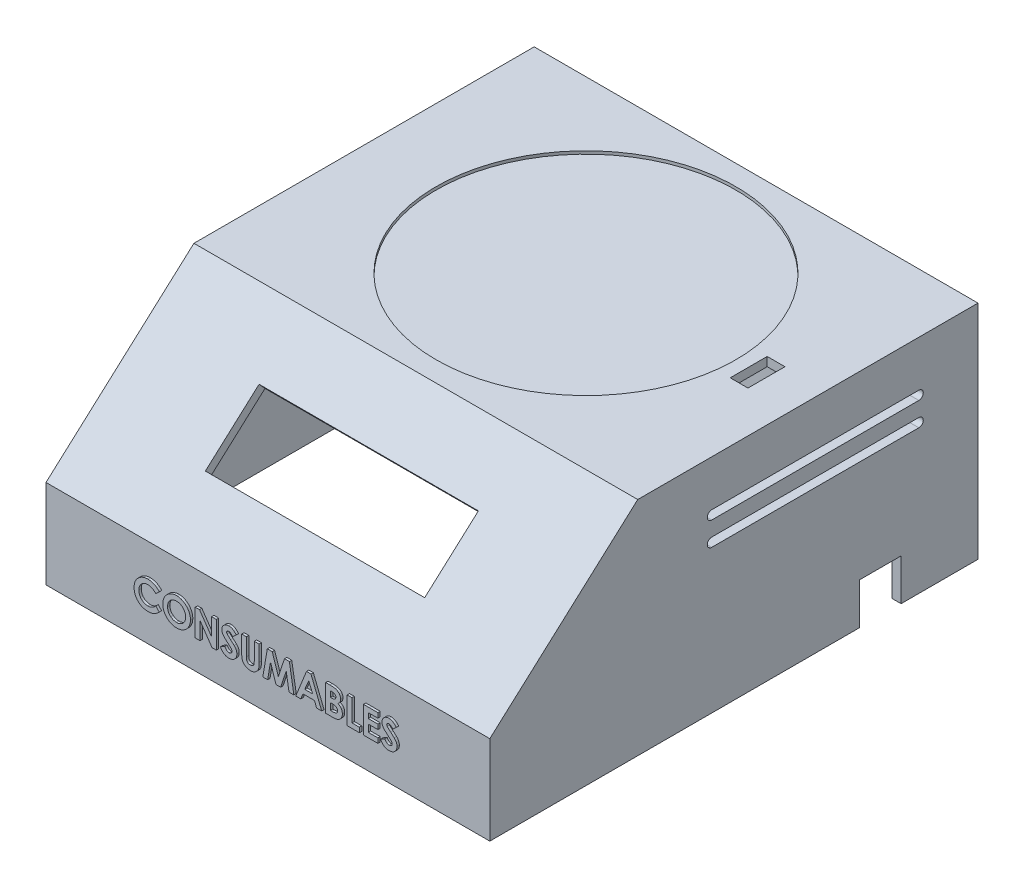
from build123d import *

# Parameters (mm, degrees)
BLOCK_DEPTH                = 150
SHELL1_T                   = -3
SKETCH2_R                  = 5
FLOOR_COLUMNS_DEPTH        = 20
SKETCH3_R                  = 2
FLOOR_INSERT_HOLES_DEPTH   = 7
SKETCH4_R                  = 50.675
SCALE_RECESS_DEPTH         = 1
SKETCH5_W                  = 6
SKETCH5_H                  = 12.5
LOAD_CELL_CABLE_SLOT_DEPTH = 4
SKETCH6_W                  = 74.13
SKETCH6_H                  = 24.42
LCD_WINDOW_DEPTH           = 4
SKETCH7_R                  = 2.5
LCD_BOSSES_DEPTH           = 5.6
SKETCH8_R                  = 1.1
LCD_M2_5_PILOTS_DEPTH      = 7.6
SKETCH9_W                  = 14
SKETCH9_H                  = 14
USB_ACCESS_DEPTH           = 4
SKETCH10_R                 = 8.15
DC_IN_DEPTH                = 4
VENTS_LEFT_DEPTH           = 4
VENTS_START                = -4
VENTS_RIGHT_DEPTH          = 4
TITLE_RAISED_DEPTH         = 0.8


with BuildPart() as part:
    # Sketch1 → Block (new body)
    with BuildSketch(Plane(origin=(-75, 0, 0), x_dir=(0, 0, -1), z_dir=(1, 0, 0))):
        Polygon((0, 0), (-165, 0), (-165, 30), (-115, 75), (0, 75), align=None)
    extrude(amount=BLOCK_DEPTH)

    # Shell1
    shell1_openings = [part.faces().sort_by_distance(p)[0] for p in [
        (0, 0, 82.5),
    ]]
    offset(amount=SHELL1_T, openings=shell1_openings, kind=Kind.INTERSECTION)

    # Sketch2 → Floor columns (add)
    with BuildSketch(Plane(origin=(0, 0, 0), x_dir=(1, 0, 0), z_dir=(0, 1, 0))):
        with Locations((-68, -7)):
            Circle(SKETCH2_R)
        with Locations((68, -7)):
            Circle(SKETCH2_R)
        with Locations((-68, -158)):
            Circle(SKETCH2_R)
        with Locations((68, -158)):
            Circle(SKETCH2_R)
    extrude(amount=FLOOR_COLUMNS_DEPTH)

    # Sketch3 → Floor insert holes (cut)
    with BuildSketch(Plane(origin=(0, 0, 0), x_dir=(1, 0, 0), z_dir=(0, 1, 0))):
        with Locations(Location((-68, -7, 0), (0, 0, 270))):
            Circle(SKETCH3_R)
        with Locations(Location((68, -7, 0), (0, 0, 270))):
            Circle(SKETCH3_R)
        with Locations(Location((-68, -158, 0), (0, 0, 270))):
            Circle(SKETCH3_R)
        with Locations(Location((68, -158, 0), (0, 0, 270))):
            Circle(SKETCH3_R)
    extrude(amount=FLOOR_INSERT_HOLES_DEPTH, mode=Mode.SUBTRACT)

    # Sketch4 → Scale recess (cut)
    with BuildSketch(Plane(origin=(0, 75, 0), x_dir=(1, 0, 0), z_dir=(0, 1, 0))):
        with Locations(Location((0, -57.5, 0), (0, 0, 270))):
            Circle(SKETCH4_R)
    extrude(amount=-SCALE_RECESS_DEPTH, mode=Mode.SUBTRACT)

    # Sketch5 → Load-cell cable slot (cut)
    with BuildSketch(Plane(origin=(0, 75, 0), x_dir=(1, 0, 0), z_dir=(0, 1, 0))):
        with Locations((58, -57.5)):
            Rectangle(SKETCH5_W, SKETCH5_H)
    extrude(amount=-LOAD_CELL_CABLE_SLOT_DEPTH, mode=Mode.SUBTRACT)

    # Sketch6 → LCD window (cut)
    with BuildSketch(Plane(origin=(0, 98.61878453, 88.756906077), x_dir=(1, 0, 0), z_dir=(0, 0.7432941462471663, 0.6689647316224498))):
        with Locations((0, -68.940532064)):
            Rectangle(SKETCH6_W, SKETCH6_H)
    extrude(amount=-LCD_WINDOW_DEPTH, mode=Mode.SUBTRACT)

    # Sketch7 → LCD bosses (add)
    with BuildSketch(Plane(origin=(0, 96.388902092, 86.750011882), x_dir=(1, 0, 0), z_dir=(0, -0.7432941462471663, -0.6689647316224498))):
        with Locations(Location((-37.5, 84.440532064, 0), (0, 0, 270))):
            Circle(SKETCH7_R)
        with Locations(Location((-37.5, 53.440532064, 0), (0, 0, 270))):
            Circle(SKETCH7_R)
        with Locations(Location((37.5, 84.440532064, 0), (0, 0, 270))):
            Circle(SKETCH7_R)
        with Locations(Location((37.5, 53.440532064, 0), (0, 0, 270))):
            Circle(SKETCH7_R)
    extrude(amount=LCD_BOSSES_DEPTH)

    # Sketch8 → LCD M2.5 pilots (cut)
    with BuildSketch(Plane(origin=(0, 92.226454873, 83.003809385), x_dir=(1, 0, 0), z_dir=(0, -0.743294146247166, -0.66896473162245))):
        with Locations(Location((-37.5, 84.440532064, 0), (0, 0, 270))):
            Circle(SKETCH8_R)
        with Locations(Location((-37.5, 53.440532064, 0), (0, 0, 270))):
            Circle(SKETCH8_R)
        with Locations(Location((37.5, 84.440532064, 0), (0, 0, 270))):
            Circle(SKETCH8_R)
        with Locations(Location((37.5, 53.440532064, 0), (0, 0, 270))):
            Circle(SKETCH8_R)
    extrude(amount=-LCD_M2_5_PILOTS_DEPTH, mode=Mode.SUBTRACT)

    # Sketch9 → USB access (cut)
    with BuildSketch(Plane(origin=(75, 0, 0), x_dir=(0, 0, -1), z_dir=(1, 0, 0))):
        with Locations((-33, 7)):
            Rectangle(SKETCH9_W, SKETCH9_H)
    extrude(amount=-USB_ACCESS_DEPTH, mode=Mode.SUBTRACT)

    # Sketch10 → DC in (cut)
    with BuildSketch(Plane.XY):
        with Locations((-38, 45)):
            Circle(SKETCH10_R)
    extrude(amount=DC_IN_DEPTH, mode=Mode.SUBTRACT)

    # Sketch11 → Vents left (cut)
    with BuildSketch(Plane(origin=(-75, 0, 0), x_dir=(0, 0, -1), z_dir=(1, 0, 0))):
        with BuildLine():
            Line((-20, 48.5), (-90, 48.5))
            ThreePointArc((-90, 48.5), (-91.5, 50), (-90, 51.5))
            Line((-90, 51.5), (-20, 51.5))
            ThreePointArc((-20, 51.5), (-18.5, 50), (-20, 48.5))
        make_face()
        with BuildLine():
            Line((-20, 56.5), (-90, 56.5))
            ThreePointArc((-90, 56.5), (-91.5, 58), (-90, 59.5))
            Line((-90, 59.5), (-20, 59.5))
            ThreePointArc((-20, 59.5), (-18.5, 58), (-20, 56.5))
        make_face()
    extrude(amount=VENTS_LEFT_DEPTH, mode=Mode.SUBTRACT)

    # Sketch12 → Vents right (cut)
    with BuildSketch(Plane(origin=(75, 0, 0), x_dir=(0, 0, -1), z_dir=(1, 0, 0)).offset(VENTS_START)):
        with BuildLine():
            Line((-20, 48.5), (-90, 48.5))
            ThreePointArc((-90, 48.5), (-91.5, 50), (-90, 51.5))
            Line((-90, 51.5), (-20, 51.5))
            ThreePointArc((-20, 51.5), (-18.5, 50), (-20, 48.5))
        make_face()
        with BuildLine():
            Line((-20, 56.5), (-90, 56.5))
            ThreePointArc((-90, 56.5), (-91.5, 58), (-90, 59.5))
            Line((-90, 59.5), (-20, 59.5))
            ThreePointArc((-20, 59.5), (-18.5, 58), (-20, 56.5))
        make_face()
    extrude(amount=VENTS_RIGHT_DEPTH, mode=Mode.SUBTRACT)

    # Sketch13 → Title (raised) (add)
    # profile 1 of 11: a face of its own
    with BuildSketch(Plane.XY.offset(165)):
        with BuildLine():
            Line((-35.884615385, 17.938701923), (-37.069110577, 16.806490385))
            add(Edge.make_bspline(
                [(-37.069110577, 16.806490385), (-37.169589109, 16.910385355), (-37.365855161, 17.113324782), (-37.682113631, 17.381998698), (-38.011010925, 17.605902055), (-38.346149001, 17.794472036), (-38.693556024, 17.937138667), (-39.049215022, 18.041102243), (-39.415396981, 18.104484906), (-39.663214846, 18.111737005), (-39.787860577, 18.115384615)],
                knots=[0, 0, 0, 0, 1.115251505, 2.178435587, 3.19620269, 4.182487026, 5.141301733, 6.088180966, 7.038406374, 8, 8, 8, 8], degree=3))
            add(Edge.make_bspline(
                [(-39.787860577, 18.115384615), (-39.891954909, 18.112502875), (-40.097373605, 18.106816079), (-40.398982081, 18.065126253), (-40.687486175, 17.994230889), (-40.963873483, 17.896523946), (-41.227330724, 17.770096346), (-41.478410268, 17.615045943), (-41.71649309, 17.432773062), (-41.938434252, 17.224220791), (-42.141458227, 16.996361762), (-42.320842836, 16.753236722), (-42.471106222, 16.495402657), (-42.594424938, 16.22547072), (-42.690485451, 15.942191533), (-42.759084726, 15.64575581), (-42.798760713, 15.33581052), (-42.80468262, 15.125112021), (-42.807692308, 15.018028846)],
                knots=[0, 0, 0, 0, 1.035432265, 2.043311493, 3.022114605, 3.98653278, 4.95457646, 5.923598177, 6.917315552, 7.932509744, 8.948865224, 9.949768934, 10.933144597, 11.912367597, 12.897413939, 13.903909035, 14.934704909, 16, 16, 16, 16], degree=3))
            add(Edge.make_bspline(
                [(-42.807692308, 15.018028846), (-42.80682495, 14.942870381), (-42.805115371, 14.794731503), (-42.786400999, 14.575592988), (-42.756266447, 14.362976821), (-42.712654285, 14.157205059), (-42.658116847, 13.95809938), (-42.594132014, 13.763942108), (-42.513863983, 13.577416059), (-42.424765257, 13.396354855), (-42.321144466, 13.225698977), (-42.209422138, 13.062964435), (-42.088277513, 12.908948936), (-41.956925931, 12.764282101), (-41.813518782, 12.631224748), (-41.66176261, 12.505775684), (-41.499097499, 12.391075325), (-41.328902414, 12.284245139), (-41.149707086, 12.191440847), (-40.9663735, 12.107378088), (-40.776121948, 12.039106629), (-40.581268857, 11.984073605), (-40.382510564, 11.937276237), (-40.177903029, 11.908461659), (-39.969219941, 11.886640717), (-39.828185201, 11.885293401), (-39.757211538, 11.884615385)],
                knots=[0, 0, 0, 0, 1.103660481, 2.175337485, 3.227646561, 4.255952547, 5.262355991, 6.258840057, 7.255597736, 8.242457506, 9.22035537, 10.185017736, 11.140346927, 12.096287581, 13.051739095, 14.01125915, 14.986044842, 15.97314143, 16.960198552, 17.947847494, 18.933482797, 19.925264591, 20.920966487, 21.929612487, 22.958107872, 24, 24, 24, 24], degree=3))
            add(Edge.make_bspline(
                [(-39.757211538, 11.884615385), (-39.636828009, 11.888097515), (-39.400305679, 11.894938996), (-39.05317515, 11.948438408), (-38.722394338, 12.036441914), (-38.458102053, 12.140368941), (-38.251036028, 12.242998229), (-38.093399725, 12.337925267), (-37.930391501, 12.444111581), (-37.764718783, 12.565564757), (-37.594518083, 12.70082731), (-37.422793836, 12.852861741), (-37.245149869, 13.016661775), (-37.128777067, 13.133569077), (-37.069110577, 13.193509615)],
                knots=[0, 0, 0, 0, 1.404581149, 2.759636711, 4.088442092, 5.392261763, 6.066678138, 6.783632037, 7.538459478, 8.336747902, 9.180226004, 10.074962426, 11.012997595, 12, 12, 12, 12], degree=3))
            Line((-37.069110577, 13.193509615), (-35.920673077, 11.987379808))
            add(Edge.make_bspline(
                [(-35.920673077, 11.987379808), (-36.001402052, 11.909438517), (-36.158967746, 11.757313786), (-36.396651221, 11.541310863), (-36.634035563, 11.347208225), (-36.865386059, 11.167960797), (-37.094492472, 11.00879049), (-37.321330507, 10.869538341), (-37.543332256, 10.746682461), (-37.765107658, 10.642294754), (-37.988036713, 10.553658749), (-38.217404514, 10.477348966), (-38.453912258, 10.412793636), (-38.699004428, 10.360705962), (-38.950394952, 10.318938679), (-39.210436513, 10.290746005), (-39.477480317, 10.271793008), (-39.658620267, 10.270089925), (-39.75, 10.269230769)],
                knots=[0, 0, 0, 0, 1.244526981, 2.429050516, 3.560637417, 4.644440555, 5.67424972, 6.652764056, 7.595344123, 8.486817594, 9.369275933, 10.254498637, 11.166417451, 12.086725134, 13.032340136, 13.991389299, 14.986715468, 16, 16, 16, 16], degree=3))
            add(Edge.make_bspline(
                [(-39.75, 10.269230769), (-39.91785325, 10.273509683), (-40.246295403, 10.281882329), (-40.727618814, 10.343917963), (-41.184863135, 10.447919611), (-41.619140754, 10.595006627), (-42.030313582, 10.782903397), (-42.418276429, 11.013256014), (-42.782403983, 11.285452467), (-43.119754813, 11.59630235), (-43.424904693, 11.939609951), (-43.694621849, 12.30822813), (-43.91773189, 12.703968512), (-44.102984965, 13.120984747), (-44.247850433, 13.561179843), (-44.349811164, 14.025029955), (-44.412689603, 14.512087208), (-44.419568593, 14.84475854), (-44.423076923, 15.014423077)],
                knots=[0, 0, 0, 0, 1.078019885, 2.10938526, 3.111377082, 4.085535484, 5.04941344, 6.010039228, 6.978205633, 7.964457913, 8.951525778, 9.924444315, 10.892603023, 11.863865945, 12.85144698, 13.863884204, 14.910567087, 16, 16, 16, 16], degree=3))
            add(Edge.make_bspline(
                [(-44.423076923, 15.014423077), (-44.421594473, 15.125076841), (-44.418656619, 15.344365555), (-44.387779503, 15.667395598), (-44.344735008, 15.982292109), (-44.27644883, 16.285785418), (-44.194136578, 16.581964141), (-44.091770478, 16.867609159), (-43.969514022, 17.143541446), (-43.831307825, 17.41022293), (-43.674956537, 17.66590656), (-43.500294984, 17.908395611), (-43.311819636, 18.139562054), (-43.105001736, 18.356339037), (-42.882846621, 18.560629904), (-42.644351285, 18.751327564), (-42.390950158, 18.931166836), (-42.121957378, 19.095510102), (-41.842598759, 19.244167322), (-41.556397746, 19.375289339), (-41.264057503, 19.484877149), (-40.966814071, 19.575776196), (-40.6634116, 19.643625907), (-40.3560157, 19.694985949), (-40.042010801, 19.723696541), (-39.831183714, 19.728396648), (-39.724759615, 19.730769231)],
                knots=[0, 0, 0, 0, 1.071919942, 2.124283339, 3.142214191, 4.149696895, 5.136002878, 6.119640489, 7.086990633, 8.058538607, 9.028339693, 9.988281803, 10.952401235, 11.916291999, 12.888973767, 13.874849856, 14.873389453, 15.898127285, 16.927174885, 17.938320013, 18.946391617, 19.950418109, 20.947802303, 21.956882652, 22.968648068, 24, 24, 24, 24], degree=3))
            add(Edge.make_bspline(
                [(-39.724759615, 19.730769231), (-39.633968947, 19.729409207), (-39.45333158, 19.726703301), (-39.184332228, 19.704146625), (-38.917484207, 19.668721594), (-38.653742915, 19.615272767), (-38.391221805, 19.551822255), (-38.133370697, 19.468742561), (-37.876121851, 19.376134586), (-37.623509834, 19.265440661), (-37.375182036, 19.144608243), (-37.136955926, 19.007519477), (-36.904831711, 18.862610653), (-36.683953124, 18.70130543), (-36.470182633, 18.52945465), (-36.264638062, 18.346256531), (-36.069123187, 18.148656625), (-35.946428906, 18.009040626), (-35.884615385, 17.938701923)],
                knots=[0, 0, 0, 0, 0.996412454, 1.982464992, 2.961075852, 3.949442424, 4.934965278, 5.923860011, 6.921385422, 7.934793307, 8.949617135, 9.951082467, 10.950285876, 11.951772932, 12.951063433, 13.960125323, 14.972308753, 16, 16, 16, 16], degree=3))
        make_face()
    # profile 2 of 11: a face of its own
    with BuildSketch(Plane.XY.offset(165)):
        with BuildLine():
            add(Edge.make_bspline(
                [(-30.039663462, 19.730769231), (-29.883187431, 19.726717786), (-29.574268307, 19.718719317), (-29.119959752, 19.652045832), (-28.682149458, 19.543410948), (-28.261035402, 19.392400601), (-27.857672004, 19.194924664), (-27.470636467, 18.95658171), (-27.101315134, 18.672873157), (-26.753492514, 18.350417459), (-26.432041682, 17.999760967), (-26.153504348, 17.622216912), (-25.915977928, 17.227567839), (-25.719115395, 16.814756275), (-25.569167935, 16.380923302), (-25.463943599, 15.928280896), (-25.396342177, 15.456957829), (-25.388566974, 15.136051062), (-25.384615385, 14.972956731)],
                knots=[0, 0, 0, 0, 1.014329547, 2.002516266, 2.970391464, 3.935626869, 4.897733899, 5.877609409, 6.878433252, 7.912639331, 8.949961323, 9.958554974, 10.949718813, 11.932905612, 12.9188844, 13.919928257, 14.942845884, 16, 16, 16, 16], degree=3))
            add(Edge.make_bspline(
                [(-25.384615385, 14.972956731), (-25.388823656, 14.811700096), (-25.397116189, 14.493938724), (-25.461183814, 14.026959084), (-25.56818014, 13.579165421), (-25.715584374, 13.149544144), (-25.908876564, 12.74017619), (-26.14177096, 12.348447802), (-26.420413202, 11.977994313), (-26.734640114, 11.629014523), (-27.080576674, 11.312240481), (-27.446978408, 11.033083904), (-27.832153499, 10.796537154), (-28.235538173, 10.602708583), (-28.65799747, 10.452285368), (-29.098487863, 10.346150859), (-29.556982095, 10.281650775), (-29.868780408, 10.273412407), (-30.027043269, 10.269230769)],
                knots=[0, 0, 0, 0, 1.051557043, 2.072126891, 3.067553643, 4.050577992, 5.02905126, 6.015227836, 7.017913613, 8.04756643, 9.074058332, 10.072836633, 11.047628519, 12.017157415, 12.98668631, 13.966869689, 14.968021931, 16, 16, 16, 16], degree=3))
            add(Edge.make_bspline(
                [(-30.027043269, 10.269230769), (-30.192567246, 10.272981905), (-30.517799234, 10.280352373), (-30.993777705, 10.350442159), (-31.449806209, 10.456021863), (-31.882053842, 10.613593906), (-32.294922679, 10.810572209), (-32.68537925, 11.0531628), (-33.053292336, 11.340964777), (-33.396551527, 11.666607426), (-33.707545186, 12.022931909), (-33.982058091, 12.399357126), (-34.213615817, 12.793007521), (-34.402226834, 13.204067329), (-34.550920184, 13.629981915), (-34.655806447, 14.07334522), (-34.717765266, 14.533093899), (-34.72639577, 14.845364393), (-34.730769231, 15.003605769)],
                knots=[0, 0, 0, 0, 1.067978421, 2.098431617, 3.099715153, 4.085208694, 5.062210972, 6.048429807, 7.046490867, 8.072918869, 9.098532598, 10.095778865, 11.076610158, 12.041847152, 13.011192615, 13.984257998, 14.978533688, 16, 16, 16, 16], degree=3))
            add(Edge.make_bspline(
                [(-34.730769231, 15.003605769), (-34.729396587, 15.110062283), (-34.72666868, 15.321627328), (-34.693808165, 15.635155925), (-34.646498471, 15.942564864), (-34.576529679, 16.242628503), (-34.49153548, 16.53746365), (-34.381413489, 16.824325906), (-34.256064862, 17.10627975), (-34.109606793, 17.379994953), (-33.946759581, 17.642953107), (-33.769078774, 17.893913793), (-33.576117597, 18.129842529), (-33.36849764, 18.352289741), (-33.145503418, 18.559793267), (-32.910068188, 18.75529061), (-32.65762588, 18.933588664), (-32.393701662, 19.099041823), (-32.119783478, 19.248658246), (-31.836986425, 19.376007271), (-31.551136679, 19.487219004), (-31.258415675, 19.574992222), (-30.961960438, 19.64648259), (-30.658603944, 19.693760397), (-30.351086848, 19.726620001), (-30.143717614, 19.729382872), (-30.039663462, 19.730769231)],
                knots=[0, 0, 0, 0, 1.034744296, 2.056386356, 3.06226378, 4.057406941, 5.050368692, 6.043467995, 7.042652155, 8.049140477, 9.059438543, 10.048523776, 11.036952808, 12.020949711, 13.004946614, 13.997082645, 14.994316842, 16.007702937, 17.024872941, 18.026463647, 19.021641123, 20.005082605, 20.995858141, 21.984425357, 22.988620895, 24, 24, 24, 24], degree=3))
        make_face()
        with BuildLine():
            add(Edge.make_bspline(
                [(-30.064903846, 18.115384615), (-30.170212194, 18.112558956), (-30.378048731, 18.106982235), (-30.682907081, 18.064495164), (-30.975581863, 17.996638483), (-31.254450666, 17.898348908), (-31.520722129, 17.773251227), (-31.774868272, 17.621782544), (-32.013369694, 17.438736293), (-32.239406582, 17.233939411), (-32.443593716, 17.00574862), (-32.62399949, 16.761203379), (-32.774970065, 16.500712075), (-32.901408867, 16.226694611), (-32.996589263, 15.936069732), (-33.064383405, 15.631113936), (-33.107226772, 15.311301767), (-33.112627231, 15.093286228), (-33.115384615, 14.981971154)],
                knots=[0, 0, 0, 0, 1.033739768, 2.040188636, 3.016340934, 3.979330865, 4.937572243, 5.900995986, 6.878200029, 7.884839167, 8.891893314, 9.879764717, 10.863503415, 11.843163062, 12.837761627, 13.859916423, 14.907309254, 16, 16, 16, 16], degree=3))
            add(Edge.make_bspline(
                [(-33.115384615, 14.981971154), (-33.111728745, 14.858609012), (-33.104563845, 14.616839653), (-33.054150738, 14.264153027), (-32.967898929, 13.931075513), (-32.843352994, 13.619236143), (-32.68888336, 13.325172174), (-32.497056591, 13.052487779), (-32.270979371, 12.799550251), (-32.096811313, 12.651874786), (-32.008413462, 12.576923077)],
                knots=[0, 0, 0, 0, 1.078454662, 2.113592447, 3.107694534, 4.079536787, 5.043276885, 6.005368276, 6.987637804, 8, 8, 8, 8], degree=3))
            add(Edge.make_bspline(
                [(-32.008413462, 12.576923077), (-31.935998745, 12.521551633), (-31.792800829, 12.412056272), (-31.564225777, 12.271715505), (-31.328838483, 12.151429468), (-31.084862653, 12.054239773), (-30.832813552, 11.977791993), (-30.572725745, 11.924256869), (-30.304967752, 11.890658949), (-30.123897249, 11.886643361), (-30.032451923, 11.884615385)],
                knots=[0, 0, 0, 0, 1.023928204, 2.024787132, 3.009472467, 3.9914905, 4.972207045, 5.96565515, 6.972602802, 8, 8, 8, 8], degree=3))
            add(Edge.make_bspline(
                [(-30.032451923, 11.884615385), (-29.928954355, 11.887465002), (-29.725319635, 11.893071715), (-29.426136388, 11.935035747), (-29.13950975, 12.00605404), (-28.863660319, 12.103481383), (-28.599383522, 12.230149775), (-28.347970951, 12.386316541), (-28.108981812, 12.570064156), (-27.883232892, 12.777550469), (-27.676887708, 13.006640174), (-27.496858403, 13.252489794), (-27.341087718, 13.509682526), (-27.217278213, 13.781858542), (-27.118337455, 14.066448629), (-27.051359251, 14.364713175), (-27.008153954, 14.675422619), (-27.002751973, 14.886871377), (-27, 14.994591346)],
                knots=[0, 0, 0, 0, 1.026359118, 2.019393844, 2.989460624, 3.950973911, 4.916101784, 5.890408035, 6.881132271, 7.902007068, 8.92769091, 9.933912415, 10.920395702, 11.90457117, 12.894218921, 13.903490204, 14.931958862, 16, 16, 16, 16], degree=3))
            add(Edge.make_bspline(
                [(-27, 14.994591346), (-27.002847192, 15.101691896), (-27.008451454, 15.312502995), (-27.050489345, 15.622413608), (-27.121057258, 15.919361403), (-27.218777165, 16.203831328), (-27.343560312, 16.476102268), (-27.497867332, 16.735216757), (-27.681156781, 16.980924297), (-27.889210264, 17.211550483), (-28.115663692, 17.423481175), (-28.358784075, 17.607398491), (-28.61176863, 17.767216791), (-28.880422059, 17.892411993), (-29.159247935, 17.992154746), (-29.449947671, 18.06560674), (-29.753622309, 18.106683761), (-29.960218443, 18.112458478), (-30.064903846, 18.115384615)],
                knots=[0, 0, 0, 0, 1.055025985, 2.07665775, 3.074803781, 4.057872707, 5.035505728, 6.020516407, 7.023567878, 8.050795229, 9.077271434, 10.074415901, 11.050397877, 12.019801805, 12.988065821, 13.964604439, 14.968634123, 16, 16, 16, 16], degree=3))
        make_face(mode=Mode.SUBTRACT)
    # profile 3 of 11: a face of its own
    with BuildSketch(Plane.XY.offset(165)):
        Polygon((-23.769230769, 19.5), (-22.314302885, 19.5), (-18.230769231, 13.577524038), (-18.230769231, 19.5), (-16.615384615, 19.5), (-16.615384615, 10.5), (-18.081129808, 10.5), (-22.153846154, 16.404447115), (-22.153846154, 10.5), (-23.769230769, 10.5), align=None)
    # profile 4 of 11: a face of its own
    with BuildSketch(Plane.XY.offset(165)):
        with BuildLine():
            Line((-9.923076923, 18.297475962), (-11.131009615, 17.192307692))
            add(Edge.make_bspline(
                [(-11.131009615, 17.192307692), (-11.182752272, 17.265296089), (-11.282090958, 17.405423633), (-11.443108606, 17.593057717), (-11.603399178, 17.753123553), (-11.764447666, 17.884952463), (-11.927681544, 17.987743485), (-12.092817463, 18.060520664), (-12.258919219, 18.106785808), (-12.370513959, 18.112546932), (-12.425480769, 18.115384615)],
                knots=[0, 0, 0, 0, 1.299362458, 2.494594718, 3.587462134, 4.587049575, 5.512617175, 6.380583204, 7.202344345, 8, 8, 8, 8], degree=3))
            add(Edge.make_bspline(
                [(-12.425480769, 18.115384615), (-12.476752233, 18.113586529), (-12.575743959, 18.110114896), (-12.716864008, 18.075607124), (-12.842152398, 18.016051778), (-12.951486852, 17.938178153), (-13.03809587, 17.844358489), (-13.107246455, 17.745965784), (-13.146184045, 17.63736249), (-13.151308998, 17.562769367), (-13.153846154, 17.525841346)],
                knots=[0, 0, 0, 0, 1.185010067, 2.2879431, 3.333075148, 4.379039566, 5.372662701, 6.27520591, 7.14612461, 8, 8, 8, 8], degree=3))
            add(Edge.make_bspline(
                [(-13.153846154, 17.525841346), (-13.152256247, 17.488380807), (-13.149054395, 17.412940486), (-13.118128868, 17.302373301), (-13.071515269, 17.19433629), (-13.026974071, 17.128569021), (-13.004206731, 17.094951923)],
                knots=[0, 0, 0, 0, 0.967525499, 1.948461899, 2.951351359, 4, 4, 4, 4], degree=3))
            add(Edge.make_bspline(
                [(-13.004206731, 17.094951923), (-12.983508755, 17.068821704), (-12.93586475, 17.008673392), (-12.845017389, 16.913407842), (-12.730932184, 16.796699203), (-12.589218895, 16.662560745), (-12.42576043, 16.506168324), (-12.232980279, 16.333669786), (-12.016427496, 16.139723051), (-11.862506794, 16.004665567), (-11.781850962, 15.933894231)],
                knots=[0, 0, 0, 0, 0.473873513, 1.090794244, 1.870441696, 2.795289791, 3.865433203, 5.087734844, 6.473946851, 8, 8, 8, 8], degree=3))
            add(Edge.make_bspline(
                [(-11.781850962, 15.933894231), (-11.70614386, 15.868373553), (-11.562467511, 15.74402892), (-11.358044597, 15.567541678), (-11.178390902, 15.408760409), (-11.020889282, 15.270068082), (-10.887927307, 15.150009495), (-10.778946005, 15.04801077), (-10.692614354, 14.966057635), (-10.643539865, 14.916557891), (-10.622596154, 14.895432692)],
                knots=[0, 0, 0, 0, 1.543621617, 2.929473131, 4.163658386, 5.240097082, 6.164993805, 6.925417477, 7.541396219, 8, 8, 8, 8], degree=3))
            add(Edge.make_bspline(
                [(-10.622596154, 14.895432692), (-10.543140079, 14.809444203), (-10.390397601, 14.644144128), (-10.191886224, 14.387980999), (-10.028504939, 14.137913551), (-9.902110079, 13.889236362), (-9.806651598, 13.638361513), (-9.739352103, 13.379136313), (-9.699045989, 13.108852021), (-9.694571069, 12.924415987), (-9.692307692, 12.831129808)],
                knots=[0, 0, 0, 0, 1.206664779, 2.319633467, 3.337109185, 4.282041471, 5.190008762, 6.099243693, 7.03861361, 8, 8, 8, 8], degree=3))
            add(Edge.make_bspline(
                [(-9.692307692, 12.831129808), (-9.693918706, 12.740233867), (-9.697079574, 12.561892648), (-9.735794148, 12.300916839), (-9.790998858, 12.051151663), (-9.876355025, 11.815314919), (-9.980386615, 11.589535418), (-10.110805239, 11.377330087), (-10.263964029, 11.176551322), (-10.439507519, 10.990788287), (-10.633679464, 10.822221209), (-10.841947329, 10.672158815), (-11.066347661, 10.548263194), (-11.304963221, 10.446243987), (-11.557666281, 10.36766743), (-11.824155797, 10.309592031), (-12.104839383, 10.274736092), (-12.296774864, 10.271092317), (-12.394831731, 10.269230769)],
                knots=[0, 0, 0, 0, 1.043214005, 2.046824704, 3.02475056, 3.976699089, 4.921714032, 5.875962561, 6.831408892, 7.817874052, 8.806269674, 9.781291748, 10.760897367, 11.74438705, 12.757449933, 13.795994037, 14.874007457, 16, 16, 16, 16], degree=3))
            add(Edge.make_bspline(
                [(-12.394831731, 10.269230769), (-12.471805536, 10.270596336), (-12.624257816, 10.273300941), (-12.848949429, 10.29538179), (-13.06591458, 10.33101793), (-13.274908879, 10.382095165), (-13.476873882, 10.446816948), (-13.671817883, 10.525872128), (-13.85839512, 10.620486029), (-14.038017322, 10.728713014), (-14.209811306, 10.854378799), (-14.375949339, 10.994914189), (-14.53478118, 11.15248068), (-14.687069665, 11.326705635), (-14.831840412, 11.518082417), (-14.973832285, 11.723945749), (-15.106734739, 11.948116175), (-15.188834497, 12.105373543), (-15.230769231, 12.185697115)],
                knots=[0, 0, 0, 0, 1.016823716, 2.013894106, 2.979844003, 3.91962641, 4.853723003, 5.779685073, 6.695824784, 7.614987388, 8.547259901, 9.504950863, 10.487499108, 11.500346958, 12.559593716, 13.656357062, 14.802919212, 16, 16, 16, 16], degree=3))
            Line((-15.230769231, 12.185697115), (-13.810096154, 13.038461538))
            add(Edge.make_bspline(
                [(-13.810096154, 13.038461538), (-13.757642069, 12.947283789), (-13.657083106, 12.77248825), (-13.486676543, 12.537628289), (-13.312103718, 12.33650961), (-13.129328664, 12.172686997), (-12.940573858, 12.043969931), (-12.74492757, 11.951979786), (-12.542252343, 11.89503799), (-12.404199186, 11.888084081), (-12.335336538, 11.884615385)],
                knots=[0, 0, 0, 0, 1.283663364, 2.460892379, 3.537111102, 4.529833553, 5.449777664, 6.316464042, 7.160231139, 8, 8, 8, 8], degree=3))
            add(Edge.make_bspline(
                [(-12.335336538, 11.884615385), (-12.265293367, 11.88744811), (-12.129399415, 11.892944011), (-11.935428186, 11.94370799), (-11.75758802, 12.02341116), (-11.603864293, 12.137136593), (-11.473700734, 12.268393027), (-11.377632556, 12.414421812), (-11.317281878, 12.572421432), (-11.310901349, 12.682178361), (-11.307692308, 12.737379808)],
                knots=[0, 0, 0, 0, 1.13588714, 2.203786484, 3.234766741, 4.283437687, 5.291419208, 6.222934724, 7.106237994, 8, 8, 8, 8], degree=3))
            add(Edge.make_bspline(
                [(-11.307692308, 12.737379808), (-11.310655726, 12.78873577), (-11.316675625, 12.893060492), (-11.361016352, 13.048174578), (-11.430334432, 13.203218121), (-11.512342609, 13.33038903), (-11.595796197, 13.436865785), (-11.675596651, 13.529123076), (-11.772772494, 13.631051231), (-11.887077331, 13.742778469), (-12.017000897, 13.865288352), (-12.162652635, 13.998568884), (-12.325700413, 14.141446023), (-12.440942904, 14.238772518), (-12.501201923, 14.289663462)],
                knots=[0, 0, 0, 0, 0.916159276, 1.861089862, 2.860218735, 3.940849679, 4.552606315, 5.27541173, 6.11797699, 7.06649574, 8.129236253, 9.306560635, 10.591630461, 12, 12, 12, 12], degree=3))
            add(Edge.make_bspline(
                [(-12.501201923, 14.289663462), (-12.615756717, 14.386587802), (-12.835622039, 14.572614948), (-13.146319634, 14.847371186), (-13.426285986, 15.104156066), (-13.673103006, 15.346144011), (-13.889915524, 15.568866064), (-14.075255192, 15.774131258), (-14.227085969, 15.963522935), (-14.386855122, 16.187844702), (-14.538667762, 16.461196188), (-14.669876963, 16.790069715), (-14.754999955, 17.118901513), (-14.764536803, 17.33966107), (-14.769230769, 17.448317308)],
                knots=[0, 0, 0, 0, 1.345494975, 2.582412109, 3.71882943, 4.751509156, 5.681369928, 6.505683931, 7.230279997, 7.856715994, 8.973648664, 10.023341002, 11.027102913, 12, 12, 12, 12], degree=3))
            add(Edge.make_bspline(
                [(-14.769230769, 17.448317308), (-14.767278555, 17.52537048), (-14.763432483, 17.677173505), (-14.729124927, 17.900377736), (-14.677850977, 18.115751064), (-14.603386482, 18.32250771), (-14.506740559, 18.520388702), (-14.389367839, 18.710362751), (-14.249445747, 18.89068138), (-14.091762996, 19.061225049), (-13.918036975, 19.217082554), (-13.732388644, 19.35464242), (-13.535868789, 19.470827483), (-13.329679619, 19.567211429), (-13.112543466, 19.640987217), (-12.886059962, 19.693283173), (-12.649904257, 19.72438714), (-12.489276244, 19.728615363), (-12.407451923, 19.730769231)],
                knots=[0, 0, 0, 0, 1.010766082, 1.991317756, 2.957454644, 3.913069143, 4.869106762, 5.843196583, 6.838735724, 7.860187025, 8.887984031, 9.89767229, 10.887916223, 11.879572884, 12.879850636, 13.892031539, 14.926195476, 16, 16, 16, 16], degree=3))
            add(Edge.make_bspline(
                [(-12.407451923, 19.730769231), (-12.301411654, 19.726890052), (-12.090168159, 19.719162315), (-11.77783856, 19.658733936), (-11.472768066, 19.563703945), (-11.226936544, 19.449060716), (-11.031332992, 19.338005766), (-10.88142114, 19.235760357), (-10.728877762, 19.118632746), (-10.57247269, 18.986253833), (-10.415112171, 18.836129424), (-10.252321695, 18.671833351), (-10.08631948, 18.49194571), (-9.978444361, 18.363434814), (-9.923076923, 18.297475962)],
                knots=[0, 0, 0, 0, 1.282922637, 2.555718331, 3.837320111, 5.142675274, 5.830281639, 6.55870424, 7.337177975, 8.157850921, 9.037902056, 9.96903443, 10.957596896, 12, 12, 12, 12], degree=3))
        make_face()
    # profile 5 of 11: a face of its own
    with BuildSketch(Plane.XY.offset(165)):
        with BuildLine():
            Line((-8.076923077, 19.5), (-6.461538462, 19.5))
            Line((-6.461538462, 19.5), (-6.461538462, 13.644230769))
            add(Edge.make_bspline(
                [(-6.461538462, 13.644230769), (-6.461450625, 13.583520694), (-6.461280969, 13.46625981), (-6.452787923, 13.298028834), (-6.445016199, 13.143389342), (-6.430993804, 13.002510634), (-6.410277921, 12.875332444), (-6.390218186, 12.761037827), (-6.363069318, 12.661673098), (-6.322268911, 12.548570022), (-6.259408877, 12.421492538), (-6.156699068, 12.289049469), (-6.038180736, 12.168175946), (-5.896129688, 12.067565404), (-5.736476873, 11.986180545), (-5.560099512, 11.92588337), (-5.367246234, 11.892366148), (-5.233898771, 11.88724913), (-5.165264423, 11.884615385)],
                knots=[0, 0, 0, 0, 1.155499968, 2.231836252, 3.205919964, 4.102923608, 4.924856345, 5.658536265, 6.31071849, 6.882491295, 7.94666036, 8.992281882, 10.060072772, 11.158554251, 12.289267114, 13.461410017, 14.693379945, 16, 16, 16, 16], degree=3))
            add(Edge.make_bspline(
                [(-5.165264423, 11.884615385), (-5.092348898, 11.886743112), (-4.950175969, 11.890891821), (-4.745682843, 11.93161589), (-4.556218803, 11.996462555), (-4.385795448, 12.089015273), (-4.234582376, 12.199955925), (-4.106583679, 12.326463034), (-4.005567578, 12.468788918), (-3.939729041, 12.600095384), (-3.902763945, 12.720951552), (-3.875056764, 12.828931952), (-3.854744335, 12.956338135), (-3.836316233, 13.10118038), (-3.825242362, 13.264958972), (-3.813234555, 13.446356784), (-3.808833583, 13.646614987), (-3.808083469, 13.786058533), (-3.807692308, 13.858774038)],
                knots=[0, 0, 0, 0, 1.261321664, 2.459363699, 3.594844139, 4.716940403, 5.803436589, 6.833651888, 7.818396249, 8.814403945, 9.360733334, 10.004355033, 10.743453831, 11.592799886, 12.532235708, 13.585170094, 14.740740724, 16, 16, 16, 16], degree=3))
            Line((-3.807692308, 13.858774038), (-3.807692308, 19.5))
            Line((-3.807692308, 19.5), (-2.192307692, 19.5))
            Line((-2.192307692, 19.5), (-2.192307692, 14.131009615))
            add(Edge.make_bspline(
                [(-2.192307692, 14.131009615), (-2.192532018, 14.022234127), (-2.192963374, 13.813069471), (-2.199587703, 13.512485141), (-2.213689701, 13.237949571), (-2.225533753, 12.989382543), (-2.24845605, 12.767118918), (-2.272335706, 12.570209566), (-2.302772381, 12.399352291), (-2.348060325, 12.204852046), (-2.426213907, 11.980892137), (-2.552207729, 11.723012011), (-2.71214873, 11.470531746), (-2.901191001, 11.226228801), (-3.114637017, 10.999279238), (-3.347754222, 10.800046898), (-3.596838966, 10.631517822), (-3.864494003, 10.497812749), (-4.150491546, 10.393532872), (-4.457661328, 10.323462047), (-4.785793882, 10.276121318), (-5.01244124, 10.271573659), (-5.129206731, 10.269230769)],
                knots=[0, 0, 0, 0, 1.170808336, 2.251350247, 3.235597562, 4.129743112, 4.929140599, 5.639994148, 6.264258765, 6.79612947, 7.788252245, 8.809469599, 9.879094798, 10.999557536, 12.129761673, 13.226370002, 14.293821979, 15.358369427, 16.438775801, 17.562147481, 18.744053101, 20, 20, 20, 20], degree=3))
            add(Edge.make_bspline(
                [(-5.129206731, 10.269230769), (-5.206788046, 10.270537524), (-5.359854389, 10.273115724), (-5.584965299, 10.295848717), (-5.802579213, 10.329348601), (-6.012287238, 10.378221481), (-6.21481723, 10.441356115), (-6.410115381, 10.519070451), (-6.597455918, 10.610931011), (-6.775790507, 10.716092874), (-6.944899694, 10.829807327), (-7.099456761, 10.955864584), (-7.244780381, 11.084942236), (-7.376672214, 11.222472419), (-7.496122886, 11.367011299), (-7.602886387, 11.51888645), (-7.696804104, 11.678084381), (-7.780238483, 11.847474625), (-7.851650169, 12.035666677), (-7.911852902, 12.249354607), (-7.964447427, 12.491887758), (-8.003532575, 12.763812546), (-8.038967399, 13.064232736), (-8.061395689, 13.393930969), (-8.073128937, 13.752916704), (-8.075626407, 14.001794072), (-8.076923077, 14.131009615)],
                knots=[0, 0, 0, 0, 1.001158378, 1.975264943, 2.917723546, 3.841610987, 4.75185031, 5.653588123, 6.552117133, 7.442167995, 8.324307438, 9.179605724, 10.014504199, 10.831958861, 11.636465792, 12.43274043, 13.225645099, 14.020104002, 14.867201867, 15.819789774, 16.883317127, 18.068162734, 19.364263498, 20.787406516, 22.332041935, 24, 24, 24, 24], degree=3))
            Line((-8.076923077, 14.131009615), (-8.076923077, 19.5))
        make_face()
    # profile 6 of 11: a face of its own
    with BuildSketch(Plane.XY.offset(165)):
        Polygon((0.596754808, 19.5), (2.269831731, 19.5), (4.326923077, 13.222355769), (6.394831731, 19.5), (8.055288462, 19.5), (9.576923077, 10.5), (7.941706731, 10.5), (6.980769231, 16.184495192), (5.109375, 10.5), (3.535456731, 10.5), (1.673076923, 16.184495192), (0.713942308, 10.5), (-0.923076923, 10.5), align=None)
    # profile 7 of 11: a face of its own
    with BuildSketch(Plane.XY.offset(165)):
        Polygon((13.844350962, 19.5), (15.346153846, 19.5), (18.980769231, 10.5), (17.255408654, 10.5), (16.555889423, 12.346153846), (12.638221154, 12.346153846), (11.936899038, 10.5), (10.211538462, 10.5), align=None)
        Polygon((14.596153846, 17.0859375), (13.251201923, 13.961538462), (15.942908654, 13.961538462), align=None, mode=Mode.SUBTRACT)
    # profile 8 of 11: a face of its own
    with BuildSketch(Plane.XY.offset(165)):
        with BuildLine():
            Line((20.307692308, 10.5), (20.307692308, 19.5))
            Line((20.307692308, 19.5), (21.75, 19.5))
            add(Edge.make_bspline(
                [(21.75, 19.5), (21.850970557, 19.500011523), (22.04634667, 19.50003382), (22.328223413, 19.490135235), (22.589640287, 19.477330305), (22.829765361, 19.463004567), (23.049007347, 19.438318457), (23.24703285, 19.412301994), (23.424237526, 19.380927743), (23.533793549, 19.352784067), (23.585336538, 19.339543269)],
                knots=[0, 0, 0, 0, 1.311965854, 2.538629056, 3.664479157, 4.713267157, 5.663616078, 6.530575999, 7.308677837, 8, 8, 8, 8], degree=3))
            add(Edge.make_bspline(
                [(23.585336538, 19.339543269), (23.653017717, 19.320866888), (23.785829918, 19.284217832), (23.976059372, 19.210203479), (24.156518545, 19.127931278), (24.3269871, 19.034074085), (24.486418294, 18.927498779), (24.634206233, 18.807359547), (24.773538338, 18.678478773), (24.899467243, 18.537264585), (25.013286225, 18.388045638), (25.112174513, 18.23086103), (25.198095761, 18.068114217), (25.266855265, 17.897757138), (25.31866426, 17.720574334), (25.356557142, 17.537322403), (25.381116861, 17.34742149), (25.383437433, 17.218225692), (25.384615385, 17.152644231)],
                knots=[0, 0, 0, 0, 1.099996261, 2.158545794, 3.195537121, 4.207578794, 5.205712374, 6.197378256, 7.190519799, 8.17788031, 9.159561366, 10.129234751, 11.085776129, 12.040971148, 13.00380137, 13.975669004, 14.972423361, 16, 16, 16, 16], degree=3))
            add(Edge.make_bspline(
                [(25.384615385, 17.152644231), (25.38153539, 17.068389268), (25.375472799, 16.902543725), (25.336744554, 16.658946628), (25.26412306, 16.428712358), (25.169099602, 16.207597785), (25.039897408, 15.996427667), (24.875835608, 15.795302411), (24.679571468, 15.598029067), (24.529026039, 15.479777004), (24.450721154, 15.418269231)],
                knots=[0, 0, 0, 0, 0.986156485, 1.941127874, 2.875419072, 3.804401753, 4.751181392, 5.761612777, 6.835722519, 8, 8, 8, 8], degree=3))
            add(Edge.make_bspline(
                [(24.450721154, 15.418269231), (24.514175676, 15.385876248), (24.638592438, 15.322362569), (24.815227689, 15.217965043), (24.97877265, 15.106925032), (25.129960607, 14.991476708), (25.26562022, 14.866726049), (25.391353101, 14.739861359), (25.500956245, 14.603613818), (25.598966678, 14.462839549), (25.684155755, 14.315500124), (25.758346046, 14.161844365), (25.821011924, 14.001347352), (25.87407901, 13.834825884), (25.913656457, 13.661707206), (25.939461794, 13.481929402), (25.959219973, 13.296105607), (25.960756974, 13.169527078), (25.961538462, 13.105168269)],
                knots=[0, 0, 0, 0, 1.164658916, 2.283573913, 3.35186032, 4.395461096, 5.390182219, 6.362969632, 7.312859996, 8.245001507, 9.165155236, 10.092416118, 11.032087915, 11.979892451, 12.947605196, 13.931445124, 14.948243989, 16, 16, 16, 16], degree=3))
            add(Edge.make_bspline(
                [(25.961538462, 13.105168269), (25.95646713, 12.982246624), (25.946458879, 12.739661249), (25.873283425, 12.383490205), (25.74642044, 12.045807751), (25.576069611, 11.727955981), (25.366164614, 11.439136182), (25.124834062, 11.186132546), (24.854507599, 10.971970585), (24.605098764, 10.827427875), (24.389379762, 10.7304262), (24.210703744, 10.670453648), (24.018809487, 10.614895166), (23.810181951, 10.575880853), (23.588603267, 10.540170663), (23.35191303, 10.518122452), (23.10055361, 10.503180923), (22.927909094, 10.501081744), (22.838942308, 10.5)],
                knots=[0, 0, 0, 0, 1.284142165, 2.534249414, 3.780121997, 5.041676246, 6.291546858, 7.49970053, 8.684500223, 9.883330709, 10.50184324, 11.153274765, 11.851151195, 12.587658647, 13.369265475, 14.195992086, 15.070362669, 16, 16, 16, 16], degree=3))
            Line((22.838942308, 10.5), (20.307692308, 10.5))
        make_face()
        with BuildLine():
            Line((21.923076923, 17.884615385), (21.923076923, 15.923076923))
            Line((21.923076923, 15.923076923), (22.352163462, 15.923076923))
            add(Edge.make_bspline(
                [(22.352163462, 15.923076923), (22.410480177, 15.923585467), (22.523057068, 15.92456718), (22.685662445, 15.937211304), (22.836859185, 15.958782964), (22.976073833, 15.988880856), (23.104603224, 16.027100792), (23.221626273, 16.073087605), (23.326628453, 16.129196515), (23.4486167, 16.212773213), (23.577567074, 16.335760067), (23.691080639, 16.513440058), (23.75793937, 16.717771372), (23.765385629, 16.861881636), (23.769230769, 16.936298077)],
                knots=[0, 0, 0, 0, 1.065314748, 2.056525647, 2.977365736, 3.853934255, 4.656397591, 5.425096493, 6.14721249, 6.826394842, 8.123232004, 9.372140726, 10.643011755, 12, 12, 12, 12], degree=3))
            add(Edge.make_bspline(
                [(23.769230769, 16.936298077), (23.766153953, 17.006001438), (23.760205054, 17.140770086), (23.692886907, 17.329997269), (23.588328518, 17.497691282), (23.464882642, 17.612464119), (23.348634363, 17.690850583), (23.249095453, 17.742464732), (23.139844025, 17.78866919), (23.018765087, 17.823998245), (22.886550069, 17.850507924), (22.74384121, 17.869976109), (22.590392291, 17.883226983), (22.484404795, 17.884142657), (22.4296875, 17.884615385)],
                knots=[0, 0, 0, 0, 1.347982417, 2.606269829, 3.849316587, 5.153353503, 5.842674298, 6.568177932, 7.326619318, 8.142485038, 9.012069166, 9.942760135, 10.937925643, 12, 12, 12, 12], degree=3))
            Line((22.4296875, 17.884615385), (21.923076923, 17.884615385))
        make_face(mode=Mode.SUBTRACT)
        with BuildLine():
            Line((21.923076923, 14.423076923), (21.923076923, 12.115384615))
            Line((21.923076923, 12.115384615), (22.388221154, 12.115384615))
            add(Edge.make_bspline(
                [(22.388221154, 12.115384615), (22.480180761, 12.115909977), (22.656984579, 12.116920051), (22.910255737, 12.129124143), (23.140542537, 12.151119867), (23.347234806, 12.178579758), (23.530649133, 12.215783615), (23.690165533, 12.263083551), (23.827971567, 12.315121719), (23.943240944, 12.379395035), (24.037409421, 12.454193237), (24.122386599, 12.530638796), (24.191671694, 12.61882597), (24.246491354, 12.714969129), (24.293937674, 12.816680007), (24.322553943, 12.927930377), (24.344341366, 13.045423046), (24.345540386, 13.126690183), (24.346153846, 13.168269231)],
                knots=[0, 0, 0, 0, 1.753078804, 3.370512758, 4.83203934, 6.162291463, 7.344201807, 8.395507345, 9.331626367, 10.147333109, 10.898971645, 11.62040215, 12.321813352, 13.025280112, 13.727906689, 14.453419512, 15.208716525, 16, 16, 16, 16], degree=3))
            add(Edge.make_bspline(
                [(24.346153846, 13.168269231), (24.344800991, 13.215815525), (24.342165994, 13.308422917), (24.32064594, 13.443778502), (24.281536971, 13.570141922), (24.232277317, 13.69074446), (24.163729891, 13.801268124), (24.082263618, 13.905537719), (23.983831563, 14.000022356), (23.873138975, 14.090436818), (23.74402703, 14.169599578), (23.596435153, 14.238287294), (23.429561544, 14.295652745), (23.242889295, 14.341327155), (23.037236762, 14.380090395), (22.811102908, 14.403236328), (22.566371053, 14.420450976), (22.396670003, 14.422181718), (22.308894231, 14.423076923)],
                knots=[0, 0, 0, 0, 0.845221588, 1.646264278, 2.427170338, 3.19324141, 3.95557735, 4.731569926, 5.540061037, 6.376114724, 7.268642756, 8.224665384, 9.265483498, 10.400594375, 11.639216012, 12.983232105, 14.439614077, 16, 16, 16, 16], degree=3))
            Line((22.308894231, 14.423076923), (21.923076923, 14.423076923))
        make_face(mode=Mode.SUBTRACT)
    # profile 9 of 11: a face of its own
    with BuildSketch(Plane.XY.offset(165)):
        Polygon((27.576923077, 19.5), (29.192307692, 19.5), (29.192307692, 12.115384615), (31.730769231, 12.115384615), (31.730769231, 10.5), (27.576923077, 10.5), align=None)
    # profile 10 of 11: a face of its own
    with BuildSketch(Plane.XY.offset(165)):
        Polygon((33.115384615, 19.5), (37.961538462, 19.5), (37.961538462, 17.884615385), (34.730769231, 17.884615385), (34.730769231, 16.153846154), (37.961538462, 16.153846154), (37.961538462, 14.538461538), (34.730769231, 14.538461538), (34.730769231, 12.115384615), (37.961538462, 12.115384615), (37.961538462, 10.5), (33.115384615, 10.5), align=None)
    # profile 11 of 11: a face of its own
    with BuildSketch(Plane.XY.offset(165)):
        with BuildLine():
            Line((44.192307692, 18.297475962), (42.984375, 17.192307692))
            add(Edge.make_bspline(
                [(42.984375, 17.192307692), (42.932632343, 17.265296089), (42.833293657, 17.405423633), (42.672276009, 17.593057717), (42.511985438, 17.753123553), (42.350936949, 17.884952463), (42.187703071, 17.987743485), (42.022567153, 18.060520664), (41.856465396, 18.106785808), (41.744870656, 18.112546932), (41.689903846, 18.115384615)],
                knots=[0, 0, 0, 0, 1.299362458, 2.494594718, 3.587462134, 4.587049575, 5.512617175, 6.380583204, 7.202344345, 8, 8, 8, 8], degree=3))
            add(Edge.make_bspline(
                [(41.689903846, 18.115384615), (41.638632382, 18.113586529), (41.539640656, 18.110114896), (41.398520607, 18.075607124), (41.273232217, 18.016051778), (41.163897764, 17.938178153), (41.077288745, 17.844358489), (41.00813816, 17.745965784), (40.96920057, 17.63736249), (40.964075617, 17.562769367), (40.961538462, 17.525841346)],
                knots=[0, 0, 0, 0, 1.185010067, 2.2879431, 3.333075148, 4.379039566, 5.372662701, 6.27520591, 7.14612461, 8, 8, 8, 8], degree=3))
            add(Edge.make_bspline(
                [(40.961538462, 17.525841346), (40.963128368, 17.488380807), (40.96633022, 17.412940486), (40.997255747, 17.302373301), (41.043869347, 17.19433629), (41.088410544, 17.128569021), (41.111177885, 17.094951923)],
                knots=[0, 0, 0, 0, 0.967525499, 1.948461899, 2.951351359, 4, 4, 4, 4], degree=3))
            add(Edge.make_bspline(
                [(41.111177885, 17.094951923), (41.13187586, 17.068821704), (41.179519866, 17.008673392), (41.270367226, 16.913407842), (41.384452432, 16.796699203), (41.526165721, 16.662560745), (41.689624185, 16.506168324), (41.882404336, 16.333669786), (42.09895712, 16.139723051), (42.252877821, 16.004665567), (42.333533654, 15.933894231)],
                knots=[0, 0, 0, 0, 0.473873513, 1.090794244, 1.870441696, 2.795289791, 3.865433203, 5.087734844, 6.473946851, 8, 8, 8, 8], degree=3))
            add(Edge.make_bspline(
                [(42.333533654, 15.933894231), (42.409240755, 15.868373553), (42.552917104, 15.74402892), (42.757340018, 15.567541678), (42.936993713, 15.408760409), (43.094495333, 15.270068082), (43.227457308, 15.150009495), (43.33643861, 15.04801077), (43.422770261, 14.966057635), (43.47184475, 14.916557891), (43.492788462, 14.895432692)],
                knots=[0, 0, 0, 0, 1.543621617, 2.929473131, 4.163658386, 5.240097082, 6.164993805, 6.925417477, 7.541396219, 8, 8, 8, 8], degree=3))
            add(Edge.make_bspline(
                [(43.492788462, 14.895432692), (43.572244536, 14.809444203), (43.724987015, 14.644144128), (43.923498392, 14.387980999), (44.086879676, 14.137913551), (44.213274536, 13.889236362), (44.308733018, 13.638361513), (44.376032512, 13.379136313), (44.416338627, 13.108852021), (44.420813547, 12.924415987), (44.423076923, 12.831129808)],
                knots=[0, 0, 0, 0, 1.206664779, 2.319633467, 3.337109185, 4.282041471, 5.190008762, 6.099243693, 7.03861361, 8, 8, 8, 8], degree=3))
            add(Edge.make_bspline(
                [(44.423076923, 12.831129808), (44.42146591, 12.740233867), (44.418305041, 12.561892648), (44.379590468, 12.300916839), (44.324385757, 12.051151663), (44.239029591, 11.815314919), (44.134998, 11.589535418), (44.004579377, 11.377330087), (43.851420586, 11.176551322), (43.675877096, 10.990788287), (43.481705151, 10.822221209), (43.273437287, 10.672158815), (43.049036954, 10.548263194), (42.810421395, 10.446243987), (42.557718334, 10.36766743), (42.291228818, 10.309592031), (42.010545232, 10.274736092), (41.818609752, 10.271092317), (41.720552885, 10.269230769)],
                knots=[0, 0, 0, 0, 1.043214005, 2.046824704, 3.02475056, 3.976699089, 4.921714032, 5.875962561, 6.831408892, 7.817874052, 8.806269674, 9.781291748, 10.760897367, 11.74438705, 12.757449933, 13.795994037, 14.874007457, 16, 16, 16, 16], degree=3))
            add(Edge.make_bspline(
                [(41.720552885, 10.269230769), (41.643579079, 10.270596336), (41.491126799, 10.273300941), (41.266435187, 10.29538179), (41.049470035, 10.33101793), (40.840475736, 10.382095165), (40.638510733, 10.446816948), (40.443566732, 10.525872128), (40.256989496, 10.620486029), (40.077367293, 10.728713014), (39.905573309, 10.854378799), (39.739435276, 10.994914189), (39.580603436, 11.15248068), (39.42831495, 11.326705635), (39.283544204, 11.518082417), (39.14155233, 11.723945749), (39.008649876, 11.948116175), (38.926550118, 12.105373543), (38.884615385, 12.185697115)],
                knots=[0, 0, 0, 0, 1.016823716, 2.013894106, 2.979844003, 3.91962641, 4.853723003, 5.779685073, 6.695824784, 7.614987388, 8.547259901, 9.504950863, 10.487499108, 11.500346958, 12.559593716, 13.656357062, 14.802919212, 16, 16, 16, 16], degree=3))
            Line((38.884615385, 12.185697115), (40.305288462, 13.038461538))
            add(Edge.make_bspline(
                [(40.305288462, 13.038461538), (40.357742546, 12.947283789), (40.458301509, 12.77248825), (40.628708073, 12.537628289), (40.803280898, 12.33650961), (40.986055951, 12.172686997), (41.174810757, 12.043969931), (41.370457045, 11.951979786), (41.573132272, 11.89503799), (41.71118543, 11.888084081), (41.780048077, 11.884615385)],
                knots=[0, 0, 0, 0, 1.283663364, 2.460892379, 3.537111102, 4.529833553, 5.449777664, 6.316464042, 7.160231139, 8, 8, 8, 8], degree=3))
            add(Edge.make_bspline(
                [(41.780048077, 11.884615385), (41.850091248, 11.88744811), (41.985985201, 11.892944011), (42.179956429, 11.94370799), (42.357796595, 12.02341116), (42.511520322, 12.137136593), (42.641683881, 12.268393027), (42.737752059, 12.414421812), (42.798102737, 12.572421432), (42.804483267, 12.682178361), (42.807692308, 12.737379808)],
                knots=[0, 0, 0, 0, 1.13588714, 2.203786484, 3.234766741, 4.283437687, 5.291419208, 6.222934724, 7.106237994, 8, 8, 8, 8], degree=3))
            add(Edge.make_bspline(
                [(42.807692308, 12.737379808), (42.80472889, 12.78873577), (42.79870899, 12.893060492), (42.754368264, 13.048174578), (42.685050184, 13.203218121), (42.603042007, 13.33038903), (42.519588418, 13.436865785), (42.439787964, 13.529123076), (42.342612122, 13.631051231), (42.228307285, 13.742778469), (42.098383719, 13.865288352), (41.95273198, 13.998568884), (41.789684202, 14.141446023), (41.674441711, 14.238772518), (41.614182692, 14.289663462)],
                knots=[0, 0, 0, 0, 0.916159276, 1.861089862, 2.860218735, 3.940849679, 4.552606315, 5.27541173, 6.11797699, 7.06649574, 8.129236253, 9.306560635, 10.591630461, 12, 12, 12, 12], degree=3))
            add(Edge.make_bspline(
                [(41.614182692, 14.289663462), (41.499627899, 14.386587802), (41.279762577, 14.572614948), (40.969064982, 14.847371186), (40.689098629, 15.104156066), (40.442281609, 15.346144011), (40.225469091, 15.568866064), (40.040129424, 15.774131258), (39.888298647, 15.963522935), (39.728529493, 16.187844702), (39.576716853, 16.461196188), (39.445507652, 16.790069715), (39.36038466, 17.118901513), (39.350847813, 17.33966107), (39.346153846, 17.448317308)],
                knots=[0, 0, 0, 0, 1.345494975, 2.582412109, 3.71882943, 4.751509156, 5.681369928, 6.505683931, 7.230279997, 7.856715994, 8.973648664, 10.023341002, 11.027102913, 12, 12, 12, 12], degree=3))
            add(Edge.make_bspline(
                [(39.346153846, 17.448317308), (39.348106061, 17.52537048), (39.351952133, 17.677173505), (39.386259689, 17.900377736), (39.437533638, 18.115751064), (39.511998133, 18.32250771), (39.608644056, 18.520388702), (39.726016776, 18.710362751), (39.865938868, 18.89068138), (40.02362162, 19.061225049), (40.197347641, 19.217082554), (40.382995972, 19.35464242), (40.579515826, 19.470827483), (40.785704996, 19.567211429), (41.002841149, 19.640987217), (41.229324654, 19.693283173), (41.465480359, 19.72438714), (41.626108372, 19.728615363), (41.707932692, 19.730769231)],
                knots=[0, 0, 0, 0, 1.010766082, 1.991317756, 2.957454644, 3.913069143, 4.869106762, 5.843196583, 6.838735724, 7.860187025, 8.887984031, 9.89767229, 10.887916223, 11.879572884, 12.879850636, 13.892031539, 14.926195476, 16, 16, 16, 16], degree=3))
            add(Edge.make_bspline(
                [(41.707932692, 19.730769231), (41.813972962, 19.726890052), (42.025216456, 19.719162315), (42.337546055, 19.658733936), (42.642616549, 19.563703945), (42.888448071, 19.449060716), (43.084051624, 19.338005766), (43.233963475, 19.235760357), (43.386506853, 19.118632746), (43.542911926, 18.986253833), (43.700272444, 18.836129424), (43.86306292, 18.671833351), (44.029065135, 18.49194571), (44.136940255, 18.363434814), (44.192307692, 18.297475962)],
                knots=[0, 0, 0, 0, 1.282922637, 2.555718331, 3.837320111, 5.142675274, 5.830281639, 6.55870424, 7.337177975, 8.157850921, 9.037902056, 9.96903443, 10.957596896, 12, 12, 12, 12], degree=3))
        make_face()
    extrude(amount=TITLE_RAISED_DEPTH)


solid = part.part
